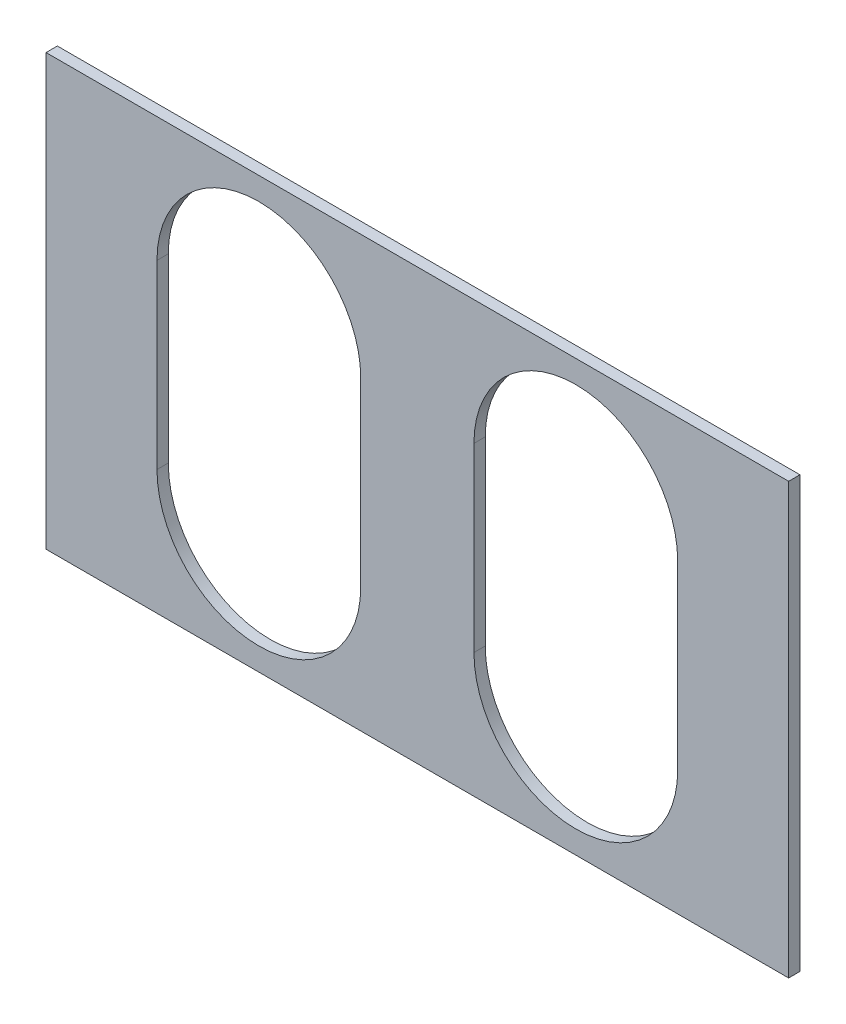
from build123d import *

# Parameters (mm, degrees)
SKETCH_1_W      = 328
SKETCH_1_H      = 190
EXTRUDE_1_DEPTH = 5


with BuildPart() as part:
    # Эскиз1 → Бобышка-Вытянуть1 (new body)
    with BuildSketch(Plane.XY):
        Rectangle(SKETCH_1_W, SKETCH_1_H)
        with BuildLine():
            Line((-25, 40), (-25, -40))
            ThreePointArc((-25, -40), (-70, -85), (-115, -40))
            Line((-115, -40), (-115, 40))
            ThreePointArc((-115, 40), (-70, 85), (-25, 40))
        make_face(mode=Mode.SUBTRACT)
        with BuildLine():
            Line((25, 40), (25, -40))
            ThreePointArc((25, -40), (70, -85), (115, -40))
            Line((115, -40), (115, 40))
            ThreePointArc((115, 40), (70, 85), (25, 40))
        make_face(mode=Mode.SUBTRACT)
    extrude(amount=EXTRUDE_1_DEPTH)


solid = part.part
